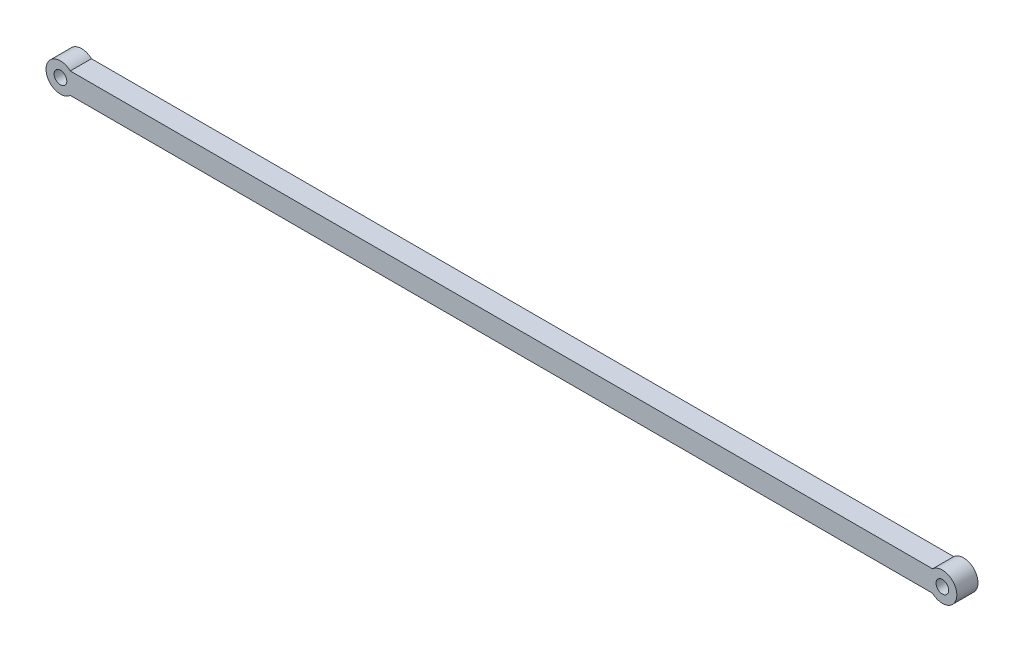
from build123d import *

# Parameters (mm, degrees)
BOSS_EXTRUDE1_DEPTH             = 290.957
BOSS_EXTRUDE1_DEPTH_BACK        = 290.957
SKETCH3_W                       = 13.97
SKETCH3_H                       = 13.97
BOSS_EXTRUDE4_REACH             = 293.125
SKETCH6_R                       = 9.525
BOSS_EXTRUDE4_DIRECTION_2_REACH = 293.125
SKETCH7_R                       = 4.191
CUT_EXTRUDE2_DEPTH              = 301.714063811


with BuildPart() as part:
    # Sketch3 → Boss-Extrude1 (new, two sides: drawn at the far end of the back side and taken through both)
    with BuildSketch(Plane(origin=(0, 0, 0), x_dir=(0, 0, -1), z_dir=(1, 0, 0)).offset(-BOSS_EXTRUDE1_DEPTH_BACK)):
        Rectangle(SKETCH3_W, SKETCH3_H)
    extrude(amount=BOSS_EXTRUDE1_DEPTH + BOSS_EXTRUDE1_DEPTH_BACK)

    # Boss-Extrude4: up to this face of the body (flat: up to its plane)
    boss_extrude4_end = Plane(part.part.faces().sort_by_distance((0, 0, -6.985))[0])
    # Sketch6 → Boss-Extrude4 (add, up to the picked face)
    with BuildSketch(Plane.XY, mode=Mode.PRIVATE) as boss_extrude4_sk1:
        with Locations((290.957, 0)):
            Circle(SKETCH6_R)
    boss_extrude4_tool1 = split(extrude(boss_extrude4_sk1.sketch, amount=-BOSS_EXTRUDE4_REACH, mode=Mode.PRIVATE), bisect_by=boss_extrude4_end, keep=Keep.BOTH, mode=Mode.PRIVATE)
    boss_extrude4 = boss_extrude4_tool1.solids().sort_by(Axis((290.957, 0, 0), (0, 0, -1)))[0]
    add(boss_extrude4)

    # Boss-Extrude4 direction 2: up to this face of the body (flat: up to its plane)
    boss_extrude4_direction_2_end = Plane(part.part.faces().sort_by_distance((0, 0, 6.985))[0])
    # Sketch6 → Boss-Extrude4 direction 2 (add, up to the picked face)
    with BuildSketch(Plane.XY, mode=Mode.PRIVATE) as boss_extrude4_direction_2_sk1:
        with Locations((290.957, 0)):
            Circle(SKETCH6_R)
    boss_extrude4_direction_2_tool1 = split(extrude(boss_extrude4_direction_2_sk1.sketch, amount=BOSS_EXTRUDE4_DIRECTION_2_REACH, mode=Mode.PRIVATE), bisect_by=boss_extrude4_direction_2_end, keep=Keep.BOTH, mode=Mode.PRIVATE)
    boss_extrude4_direction_2 = boss_extrude4_direction_2_tool1.solids().sort_by(Axis((290.957, 0, 0), (0, 0, 1)))[0]
    add(boss_extrude4_direction_2)

    # Sketch7 → Cut-Extrude2 (cut, symmetric)
    with BuildSketch(Plane.XY):
        with Locations((290.957, 0)):
            Circle(SKETCH7_R)
    cut_extrude2 = extrude(amount=CUT_EXTRUDE2_DEPTH, both=True, mode=Mode.SUBTRACT)

    # Mirror3: Boss-Extrude4, Boss-Extrude4 direction 2, Cut-Extrude2 across plane
    add(boss_extrude4.mirror(Plane(origin=(0, 0, 0), x_dir=(0, 0, 1), z_dir=(1, 0, 0))))
    add(boss_extrude4_direction_2.mirror(Plane(origin=(0, 0, 0), x_dir=(0, 0, 1), z_dir=(1, 0, 0))))
    add(cut_extrude2.mirror(Plane(origin=(0, 0, 0), x_dir=(0, 0, 1), z_dir=(1, 0, 0))), mode=Mode.SUBTRACT)


solid = part.part
